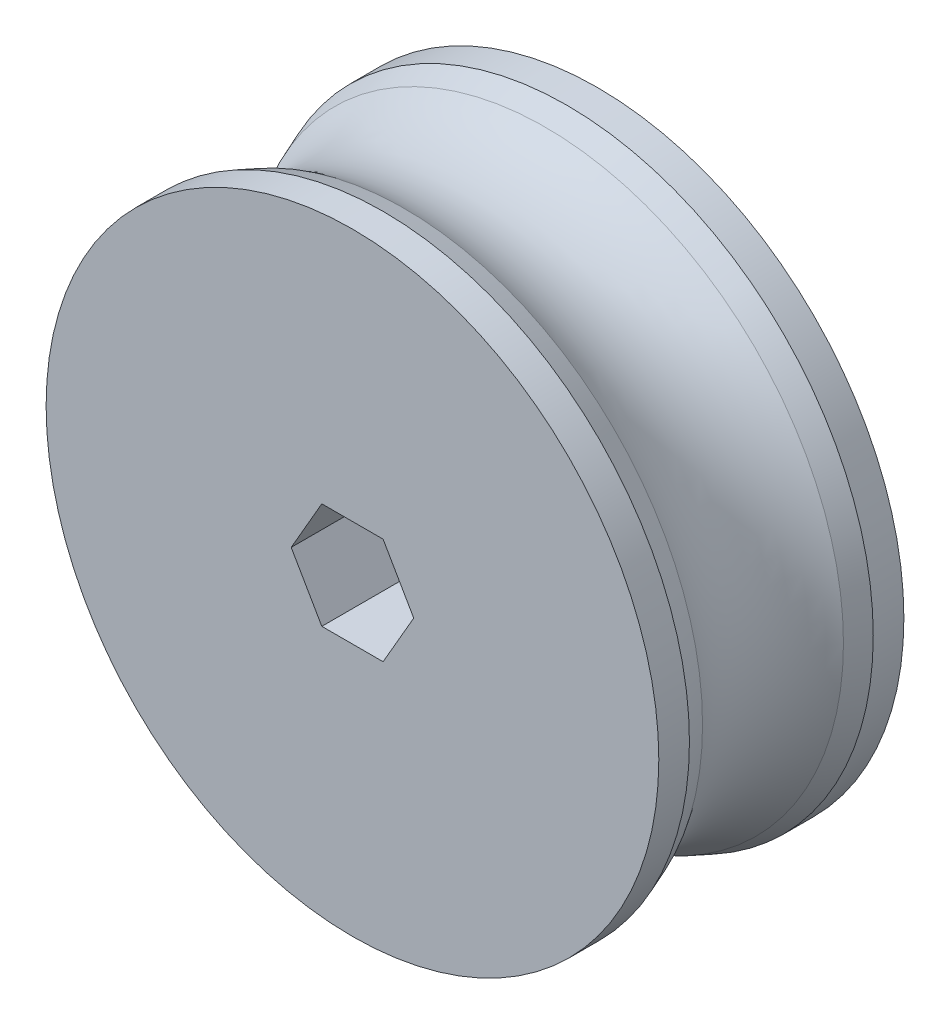
from build123d import *

# Parameters (mm, degrees)
SKETCH1_R           = 25
BOSS_EXTRUDE1_DEPTH = 20
CUT_EXTRUDE1_DEPTH  = 41.620192023


with BuildPart() as part:
    # Sketch1 → Boss-Extrude1 (new body)
    with BuildSketch(Plane.XY):
        Circle(SKETCH1_R)
    extrude(amount=BOSS_EXTRUDE1_DEPTH)

    # Sketch2 → Cut-Revolve1 (revolve, cut)
    with BuildSketch(Plane(origin=(0, 0, 0), x_dir=(0, 0, -1), z_dir=(1, 0, 0)), mode=Mode.PRIVATE) as cut_revolve1_sk:
        with BuildLine():
            Line((-17.5, 25), (-15.75, 24.318465914))
            ThreePointArc((-15.75, 24.318465914), (-10, 22.5), (-4.25, 24.318465914))
            Line((-4.25, 24.318465914), (-2.5, 25))
            Line((-2.5, 25), (-17.5, 25))
        make_face()
    revolve(cut_revolve1_sk.sketch.rotate(Axis((0, 0, 20), (0, 0, -1)), 90), axis=Axis((0, 0, 20), (0, 0, -1)), mode=Mode.SUBTRACT)

    # Sketch3 → Cut-Extrude1 (cut, through all)
    with BuildSketch(Plane(origin=(0, 0, 0), x_dir=(-1, 0, 0), z_dir=(0, 0, -1))):
        Polygon((5, 0), (2.5, 4.330127019), (-2.5, 4.330127019), (-5, 0), (-2.5, -4.330127019), (2.5, -4.330127019), align=None)
    extrude(amount=-CUT_EXTRUDE1_DEPTH, mode=Mode.SUBTRACT)


solid = part.part
